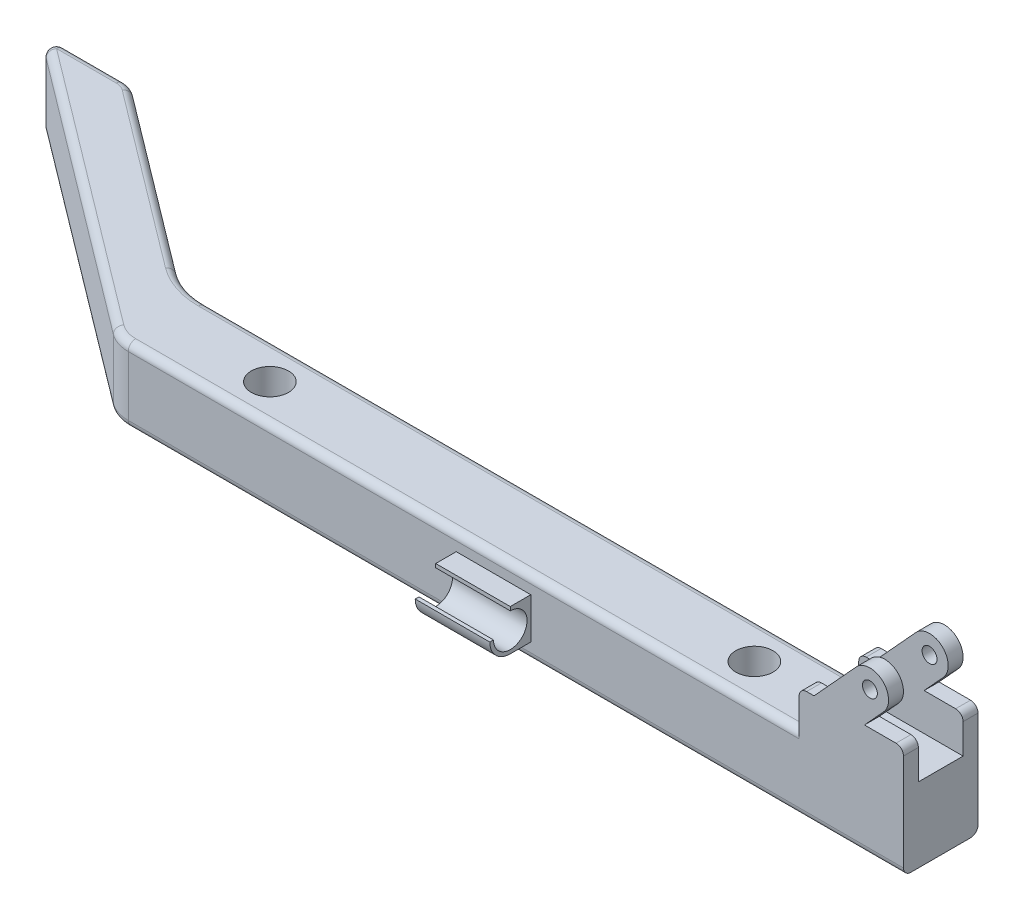
from build123d import *

# Parameters (mm, degrees)
BOSS_EXTRUDE2_DEPTH = 5
SKETCH3_W           = 14
SKETCH3_H           = 5
SKETCH3_W_2         = 10
SKETCH3_H_2         = 7
BOSS_EXTRUDE3_DEPTH = 2
SKETCH4_R           = 1
CUT_EXTRUDE1_DEPTH  = 96.580030811
FILLET1_R           = 1
FILLET2_R           = 1
SKETCH5_R           = 2.5
CUT_EXTRUDE2_DEPTH  = 97.594732206
BOSS_EXTRUDE4_DEPTH = 5


with BuildPart() as part:
    # Sketch1 → Boss-Extrude2 (new, symmetric)
    with BuildSketch(Plane(origin=(0, 0, 0), x_dir=(1, 0, 0), z_dir=(0, 1, 0))):
        with BuildLine():
            Line((-49, 0), (49, 0))
            Line((49, 0), (55, 0))
            Line((55, 0), (55, 10))
            Line((55, 10), (49, 10))
            Line((49, 10), (-48.597064799, 10))
            ThreePointArc((-48.597064799, 10), (-51.770174838, 10.516784686), (-54.615321941, 12.013725463))
            Line((-54.615321941, 12.013725463), (-78.198331144, 29.785292532))
            ThreePointArc((-78.198331144, 29.785292532), (-79.051875275, 30.234374765), (-80.003808287, 30.389410171))
            Line((-80.003808287, 30.389410171), (-88.011381516, 30.389410171))
            ThreePointArc((-88.011381516, 30.389410171), (-88.959703047, 29.706721175), (-88.61320723, 28.590782717))
            Line((-88.61320723, 28.590782717), (-52.009128571, 1.006862732))
            ThreePointArc((-52.009128571, 1.006862732), (-50.586555019, 0.258392343), (-49, 0))
        make_face()
    extrude(amount=BOSS_EXTRUDE2_DEPTH, both=True)

    # Sketch3 → Boss-Extrude3 (add)
    with BuildSketch(Plane.XY):
        with Locations((48, 7.5)):
            Rectangle(SKETCH3_W, SKETCH3_H)
        with Locations((48, 13.5)):
            Rectangle(SKETCH3_W_2, SKETCH3_H_2)
    boss_extrude3 = extrude(amount=-BOSS_EXTRUDE3_DEPTH)

    # Sketch4 → Cut-Extrude1 (cut, through all)
    with BuildSketch(Plane.XY):
        with BuildLine():
            ThreePointArc((41, 9), (41.292893219, 9.707106781), (42, 10))
            Line((42, 10), (41, 10))
            Line((41, 10), (41, 9))
        make_face()
        with BuildLine():
            Line((43, 17), (43, 10))
            Line((43, 10), (48.581791004, 16.103269862))
            ThreePointArc((48.581791004, 16.103269862), (49.441268366, 16.764748844), (50.5, 17))
            Line((50.5, 17), (43, 17))
        make_face()
        with BuildLine():
            Line((52.267766953, 12.732233047), (49.768982827, 10))
            Line((49.768982827, 10), (53, 10))
            Line((53, 10), (53, 14.5))
            ThreePointArc((53, 14.5), (52.809698831, 13.543291419), (52.267766953, 12.732233047))
        make_face()
        with BuildLine():
            Line((53, 17), (50.5, 17))
            ThreePointArc((50.5, 17), (52.267766953, 16.267766953), (53, 14.5))
            Line((53, 14.5), (53, 17))
        make_face()
        with BuildLine():
            Line((55, 10), (54, 10))
            ThreePointArc((54, 10), (54.707106781, 9.707106781), (55, 9))
            Line((55, 9), (55, 10))
        make_face()
        with Locations((50.5, 14.5)):
            Circle(SKETCH4_R)
    cut_extrude1 = extrude(amount=-CUT_EXTRUDE1_DEPTH, mode=Mode.SUBTRACT)

    # Mirror1: Boss-Extrude3, Cut-Extrude1 across plane
    add(boss_extrude3.mirror(Plane.XY.offset(-5)))
    add(cut_extrude1.mirror(Plane.XY.offset(-5)), mode=Mode.SUBTRACT)

    # Fillet1
    fillet1_edges = [part.edges().sort_by_distance(p)[0] for p in [
        (3, -5, 0),
        (-50.586555019, -5, -0.258392343),
        (-70.3111679, -5, -14.798822724),
        (-88.959703047, -5, -29.706721175),
        (-84.007594901, -5, -30.389410171),
        (-79.051875275, -5, -30.234374765),
        (-66.406826543, -5, -20.899508998),
        (-51.770174838, -5, -10.516784686),
        (3.2014676, -5, -10),
    ]]
    fillet(fillet1_edges, radius=FILLET1_R)

    # Fillet2
    fillet2_edges = [part.edges().sort_by_distance(p)[0] for p in [
        (-3.7985324, 5, -10),
        (-51.770174838, 5, -10.516784686),
        (-66.406826543, 5, -20.899508998),
        (-79.051875275, 5, -30.234374765),
        (-84.007594901, 5, -30.389410171),
        (-88.959703047, 5, -29.706721175),
        (-70.3111679, 5, -14.798822724),
        (-50.586555019, 5, -0.258392343),
        (-4, 5, 0),
    ]]
    fillet(fillet2_edges, radius=FILLET2_R)

    # Sketch5 → Cut-Extrude2 (cut, through all)
    with BuildSketch(Plane.XZ.offset(5)):
        with Locations(Location((-35, -5, 0), (0, 0, 270))):
            Circle(SKETCH5_R)
        with Locations(Location((30, -5, 0), (0, 0, 270))):
            Circle(SKETCH5_R)
    extrude(amount=-CUT_EXTRUDE2_DEPTH, mode=Mode.SUBTRACT)

    # Sketch8 → Boss-Extrude4 (add, symmetric)
    with BuildSketch(Plane(origin=(0, 0, 0), x_dir=(0, 0, -1), z_dir=(1, 0, 0))):
        with BuildLine():
            Line((0, 2.75), (0, -2.75))
            Line((0, -2.75), (-2.75, -2.75))
            ThreePointArc((-2.75, -2.75), (-4.694543648, -1.944543648), (-5.5, 0))
            Line((-5.5, 0), (-5, 0))
            ThreePointArc((-5, 0), (-4.340990258, -1.590990258), (-2.75, -2.25))
            ThreePointArc((-2.75, -2.25), (-0.5, 0), (-2.75, 2.25))
            Line((-2.75, 2.25), (-2.75, 2.75))
            Line((-2.75, 2.75), (0, 2.75))
        make_face()
    extrude(amount=BOSS_EXTRUDE4_DEPTH, both=True)


solid = part.part
